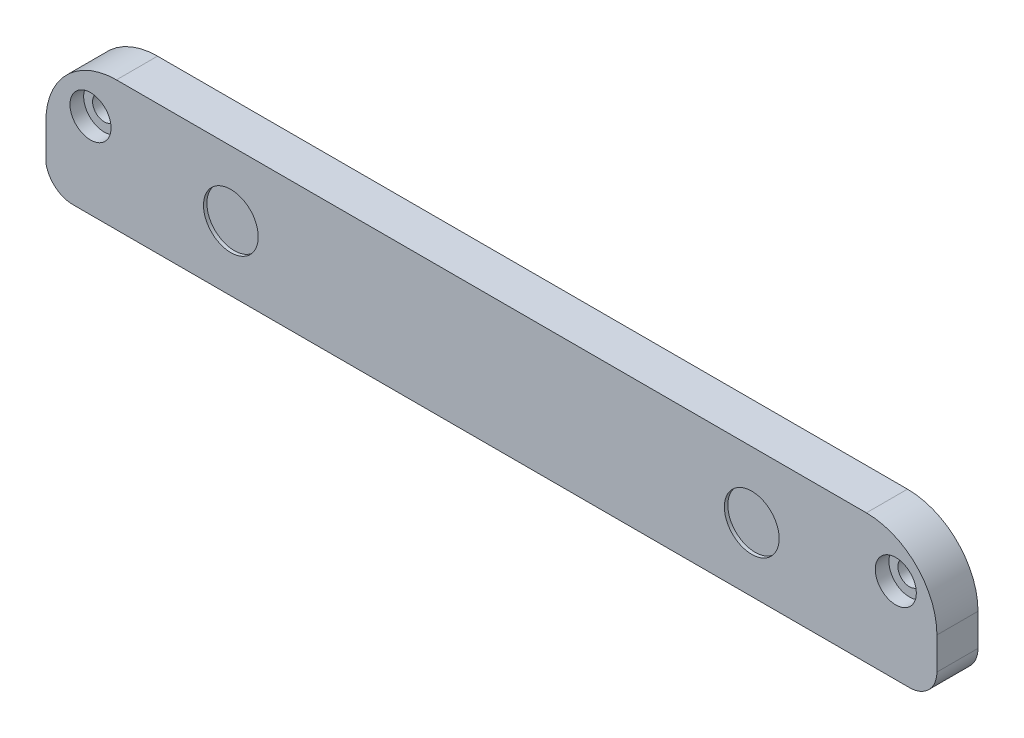
from build123d import *

# Parameters (mm, degrees)
SKIZZE1_R                       = 1.7
AUFSATZ_LINEAR_AUSTRAGEN1_DEPTH = 6
SKIZZE2_R                       = 4
SCHNITT_LINEAR_AUSTRAGEN1_DEPTH = 0.5
SKIZZE3_R                       = 3
SCHNITT_LINEAR_AUSTRAGEN2_DEPTH = 2


with BuildPart() as part:
    # Skizze1 → Aufsatz-Linear austragen1 (new body)
    with BuildSketch(Plane.XY):
        with BuildLine():
            Line((-49.2275, -51.8905), (-49.2275, -56.581162408))
            ThreePointArc((-49.2275, -56.581162408), (-50.407885162, -59.393344486), (-53.227421196, -60.556054132))
            Line((-53.227421196, -60.556054132), (-175.420431309, -60.556054132))
            ThreePointArc((-175.420431309, -60.556054132), (-177.965722471, -59.641745773), (-179.34742314, -57.316800583))
            Line((-179.34742314, -57.316800583), (-179.34742314, -52.3842))
            ThreePointArc((-179.34742314, -52.3842), (-176.514207067, -44.783915623), (-169.0581, -41.5905))
            Line((-169.0581, -41.5905), (-59.5275, -41.5905))
            ThreePointArc((-59.5275, -41.5905), (-52.244300154, -44.607300154), (-49.2275, -51.8905))
        make_face()
        with Locations((-55.2338, -48.0905)):
            Circle(SKIZZE1_R, mode=Mode.SUBTRACT)
        with Locations((-172.84742314, -48.0905)):
            Circle(SKIZZE1_R, mode=Mode.SUBTRACT)
    extrude(amount=AUFSATZ_LINEAR_AUSTRAGEN1_DEPTH)

    # Skizze2 → Schnitt-Linear austragen1 (cut)
    with BuildSketch(Plane.XY.offset(6)):
        with Locations((-152.34742314, -51.0905)):
            Circle(SKIZZE2_R)
        with Locations(Location((-76.269564564, -51.215358923, 0), (0, 0, 180))):
            Circle(SKIZZE2_R)
    extrude(amount=-SCHNITT_LINEAR_AUSTRAGEN1_DEPTH, mode=Mode.SUBTRACT)

    # Skizze3 → Schnitt-Linear austragen2 (cut)
    with BuildSketch(Plane.XY.offset(6)):
        with Locations((-172.84742314, -48.0905)):
            Circle(SKIZZE3_R)
        with Locations((-55.2338, -48.0905)):
            Circle(SKIZZE3_R)
    extrude(amount=-SCHNITT_LINEAR_AUSTRAGEN2_DEPTH, mode=Mode.SUBTRACT)


solid = part.part
